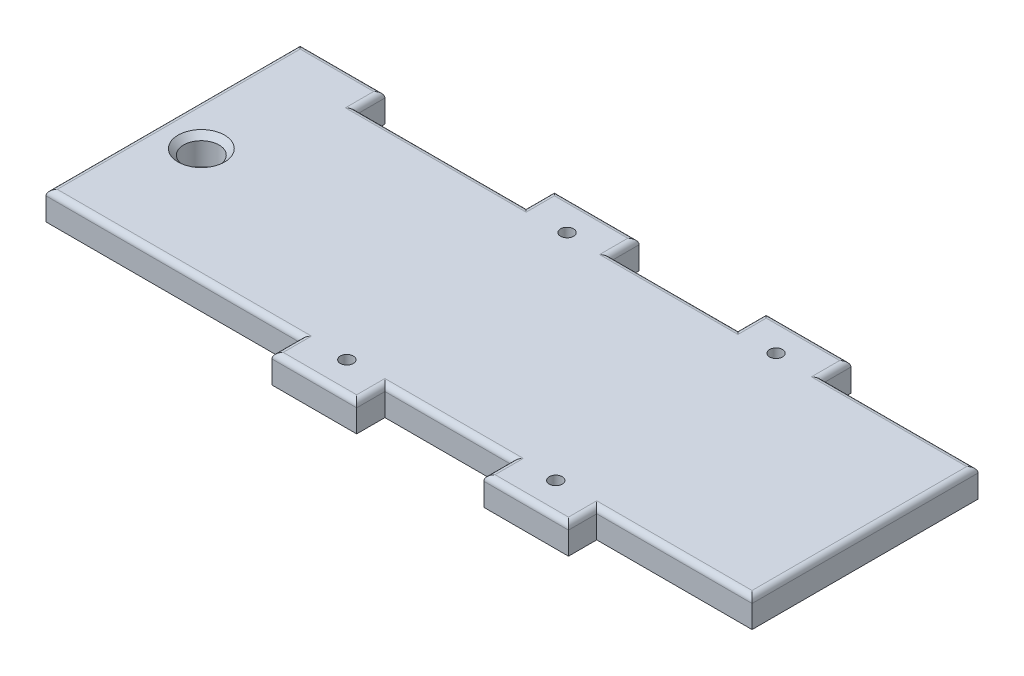
from build123d import *

# Parameters (mm, degrees)
SKETCH1_W           = 260
SKETCH1_H           = 100
BOSS_EXTRUDE1_DEPTH = 10
SKETCH3_W           = 55
SKETCH3_H           = 10
SKETCH3_W_2         = 60
SKETCH3_W_3         = 45
CUT_EXTRUDE2_DEPTH  = 140.642400438
FILLET1_R           = 2
SKETCH2_R           = 6.25
CUT_EXTRUDE1_DEPTH  = 140.642400438
CHAMFER1_SIZE       = 2
SKETCH4_R           = 2.3
CUT_EXTRUDE3_DEPTH  = 6.2


with BuildPart() as part:
    # Sketch1 → Boss-Extrude1 (new body)
    with BuildSketch(Plane(origin=(0, 0, 0), x_dir=(1, 0, 0), z_dir=(0, 1, 0))):
        Rectangle(SKETCH1_W, SKETCH1_H)
    extrude(amount=BOSS_EXTRUDE1_DEPTH)

    # Sketch3 → Cut-Extrude2 (cut, through all)
    with BuildSketch(Plane(origin=(0, 10, 0), x_dir=(1, 0, 0), z_dir=(0, 1, 0))):
        with Locations((102.5, 45)):
            Rectangle(SKETCH3_W, SKETCH3_H)
        with Locations((102.5, -45)):
            Rectangle(SKETCH3_W, SKETCH3_H)
        Polygon((-130, -50), (-30, -50), (-30, -40), (-120, -40), (-120, 50), (-130, 50), (-130, -40), align=None)
        with Locations((-60, 45)):
            Rectangle(SKETCH3_W_2, SKETCH3_H)
        with Locations((22.5, 45)):
            Rectangle(SKETCH3_W_3, SKETCH3_H)
        with Locations((22.5, -45)):
            Rectangle(SKETCH3_W_3, SKETCH3_H)
    extrude(amount=-CUT_EXTRUDE2_DEPTH, mode=Mode.SUBTRACT)

    # Fillet1
    fillet1_edges = [part.edges().sort_by_distance(p)[0] for p in [
        (-15, 10, 50),
        (60, 10, 50),
        (130, 10, 0),
        (60, 10, -50),
        (-15, 10, -50),
        (-105, 10, -50),
        (0, 10, -45),
        (22.5, 10, -40),
        (45, 10, -45),
        (-90, 10, -45),
        (-60, 10, -40),
        (-30, 10, -45),
        (-30, 10, 45),
        (-75, 10, 40),
        (-120, 10, -5),
        (102.5, 10, 40),
        (75, 10, 45),
        (0, 10, 45),
        (45, 10, 45),
        (22.5, 10, 40),
        (75, 10, -45),
        (102.5, 10, -40),
    ]]
    fillet(fillet1_edges, radius=FILLET1_R)

    # Sketch2 → Cut-Extrude1 (cut, through all)
    with BuildSketch(Plane(origin=(0, 10, 0), x_dir=(1, 0, 0), z_dir=(0, 1, 0))):
        with Locations(Location((-105, 0, 0), (0, 0, 270))):
            Circle(SKETCH2_R)
    extrude(amount=-CUT_EXTRUDE1_DEPTH, mode=Mode.SUBTRACT)

    # Chamfer1
    chamfer1_edges = [part.edges().sort_by_distance(p)[0] for p in [
        (-105, 10, -6.25),
    ]]
    chamfer(chamfer1_edges, length=CHAMFER1_SIZE)

    # Sketch4 → Cut-Extrude3 (cut)
    with BuildSketch(Plane(origin=(0, 10, 0), x_dir=(1, 0, 0), z_dir=(0, 1, 0))):
        with Locations(Location((59.5, 39, 0), (0, 0, 270))):
            Circle(SKETCH4_R)
        with Locations(Location((-14.5, 39, 0), (0, 0, 270))):
            Circle(SKETCH4_R)
        with Locations(Location((59.5, -39, 0), (0, 0, 270))):
            Circle(SKETCH4_R)
        with Locations(Location((-14.5, -39, 0), (0, 0, 270))):
            Circle(SKETCH4_R)
    extrude(amount=-CUT_EXTRUDE3_DEPTH, mode=Mode.SUBTRACT)


solid = part.part
